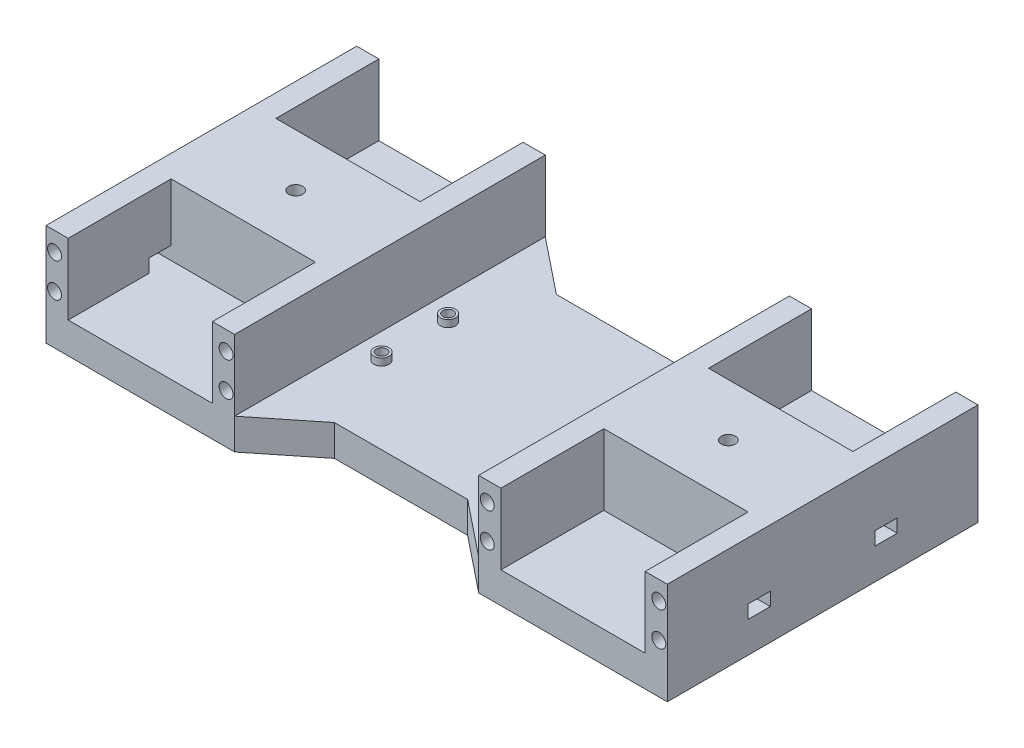
from build123d import *

# Parameters (mm, degrees)
SKETCH2_W           = 41.275
SKETCH2_H           = 29.464
BOSS_EXTRUDE1_DEPTH = 8.89
BOSS_EXTRUDE2_DEPTH = 29.14396
SKETCH6_R           = 2
CUT_EXTRUDE1_DEPTH  = 6.5
SKETCH7_R           = 2
CUT_EXTRUDE2_DEPTH  = 6
SKETCH8_R           = 2.135
SKETCH8_R_2         = 1.5
EXTRUDE_THIN1_DEPTH = 2
CUT_EXTRUDE3_START  = -21.78
SKETCH8_3_R         = 1.5
CUT_EXTRUDE3_DEPTH  = 21.78
CUT_EXTRUDE4_START  = -82.9
SKETCH7_2_R         = 2
CUT_EXTRUDE4_DEPTH  = 6
SKETCH9_W           = 6.35
SKETCH9_H           = 3.81
CUT_EXTRUDE5_DEPTH  = 6.35
CUT_EXTRUDE6_START  = -177.8
SKETCH9_2_W         = 6.35
SKETCH9_2_H         = 3.81
CUT_EXTRUDE6_DEPTH  = 6.35


with BuildPart() as part:
    # Sketch2 → Boss-Extrude1 (new body)
    with BuildSketch(Plane(origin=(0, 0, 0), x_dir=(1, 0, 0), z_dir=(0, 1, 0))):
        with Locations((26.9875, 74.168)):
            Rectangle(SKETCH2_W, SKETCH2_H)
        with Locations((26.9875, 14.732)):
            Rectangle(SKETCH2_W, SKETCH2_H)
        Polygon((0, 88.9), (0, 0), (6.35, 0), (6.35, 29.464), (47.625, 29.464), (47.625, 0), (53.975, 0), (53.975, 12.7), (53.975, 76.2), (53.975, 88.9), (47.625, 88.9), (47.625, 59.436), (6.35, 59.436), (6.35, 88.9), align=None)
        Polygon((53.975, 12.7), (69.85, 12.7), (107.95, 12.7), (123.825, 12.7), (123.825, 76.2), (107.95, 76.2), (69.85, 76.2), (53.975, 76.2), align=None)
        Polygon((53.975, 12.7), (53.975, 0), (69.85, 12.7), align=None)
        Polygon((107.95, 12.7), (123.825, 0), (123.825, 12.7), align=None)
        Polygon((123.825, 12.7), (123.825, 0), (130.175, 0), (130.175, 29.464), (171.45, 29.464), (171.45, 0), (177.8, 0), (177.8, 88.9), (171.45, 88.9), (171.45, 59.436), (130.175, 59.436), (130.175, 88.9), (123.825, 88.9), (123.825, 76.2), align=None)
        with Locations((150.8125, 14.732)):
            Rectangle(SKETCH2_W, SKETCH2_H)
        with Locations((150.8125, 74.168)):
            Rectangle(SKETCH2_W, SKETCH2_H)
        Polygon((123.825, 76.2), (123.825, 88.9), (107.95, 76.2), align=None)
        Polygon((69.85, 76.2), (53.975, 88.9), (53.975, 76.2), align=None)
    extrude(amount=BOSS_EXTRUDE1_DEPTH)

    # Sketch2<3> → Boss-Extrude2 (add)
    with BuildSketch(Plane(origin=(0, 0, 0), x_dir=(1, 0, 0), z_dir=(0, 1, 0))):
        Polygon((0, 88.9), (0, 0), (6.35, 0), (6.35, 29.464), (47.625, 29.464), (47.625, 0), (53.975, 0), (53.975, 12.7), (53.975, 76.2), (53.975, 88.9), (47.625, 88.9), (47.625, 59.436), (6.35, 59.436), (6.35, 88.9), align=None)
        Polygon((123.825, 12.7), (123.825, 0), (130.175, 0), (130.175, 29.464), (171.45, 29.464), (171.45, 0), (177.8, 0), (177.8, 88.9), (171.45, 88.9), (171.45, 59.436), (130.175, 59.436), (130.175, 88.9), (123.825, 88.9), (123.825, 76.2), align=None)
    extrude(amount=BOSS_EXTRUDE2_DEPTH)

    # Sketch6 → Cut-Extrude1 (cut)
    with BuildSketch(Plane(origin=(0, 29.14396, 0), x_dir=(1, 0, 0), z_dir=(0, 1, 0))):
        with Locations(Location((26.9875, 44.45, 0), (0, 0, 270))):
            Circle(SKETCH6_R)
        with Locations(Location((150.8125, 44.45, 0), (0, 0, 270))):
            Circle(SKETCH6_R)
    extrude(amount=-CUT_EXTRUDE1_DEPTH, mode=Mode.SUBTRACT)

    # Sketch7 → Cut-Extrude2 (cut)
    with BuildSketch(Plane.XY):
        with Locations((2.4375, 14.04)):
            Circle(SKETCH7_R)
        with Locations((51.5375, 14.04)):
            Circle(SKETCH7_R)
        with Locations((2.4375, 23.740006)):
            Circle(SKETCH7_R)
        with Locations((51.5375, 23.740006)):
            Circle(SKETCH7_R)
        with Locations(Location((126.2625, 23.740006, 0), (0, 0, 180))):
            Circle(SKETCH7_R)
        with Locations(Location((175.3625, 23.740006, 0), (0, 0, 180))):
            Circle(SKETCH7_R)
        with Locations(Location((126.2625, 14.04, 0), (0, 0, 180))):
            Circle(SKETCH7_R)
        with Locations(Location((175.3625, 14.04, 0), (0, 0, 180))):
            Circle(SKETCH7_R)
    extrude(amount=-CUT_EXTRUDE2_DEPTH, mode=Mode.SUBTRACT)

    # Sketch8 → Extrude-Thin1 (add)
    # profile 1 of 4: a face of its own
    with BuildSketch(Plane(origin=(0, 8.89, 0), x_dir=(1, 0, 0), z_dir=(0, 1, 0))):
        with Locations((61.087, 53.975)):
            Circle(SKETCH8_R)
        with Locations((61.087, 53.975)):
            Circle(SKETCH8_R_2, mode=Mode.SUBTRACT)
    # profile 2 of 4: a face of its own
    with BuildSketch(Plane(origin=(0, 8.89, 0), x_dir=(1, 0, 0), z_dir=(0, 1, 0))):
        with Locations((61.087, 34.925)):
            Circle(SKETCH8_R)
        with Locations((61.087, 34.925)):
            Circle(SKETCH8_R_2, mode=Mode.SUBTRACT)
    # profile 3 of 4: a face of its own
    with BuildSketch(Plane(origin=(0, 8.89, 0), x_dir=(1, 0, 0), z_dir=(0, 1, 0))):
        with Locations((116.713, 34.925)):
            Circle(SKETCH8_R)
        with Locations((116.713, 34.925)):
            Circle(SKETCH8_R_2, mode=Mode.SUBTRACT)
    # profile 4 of 4: a face of its own
    with BuildSketch(Plane(origin=(0, 8.89, 0), x_dir=(1, 0, 0), z_dir=(0, 1, 0))):
        with Locations((116.713, 53.975)):
            Circle(SKETCH8_R)
        with Locations((116.713, 53.975)):
            Circle(SKETCH8_R_2, mode=Mode.SUBTRACT)
    extrude(amount=EXTRUDE_THIN1_DEPTH)

    # Sketch8<3> → Cut-Extrude3 (cut)
    with BuildSketch(Plane(origin=(0, 8.89, 0), x_dir=(1, 0, 0), z_dir=(0, 1, 0)).offset(CUT_EXTRUDE3_START)):
        with Locations(Location((61.087, 53.975, 0), (0, 0, 270))):
            Circle(SKETCH8_3_R)
        with Locations(Location((61.087, 34.925, 0), (0, 0, 270))):
            Circle(SKETCH8_3_R)
        with Locations(Location((116.713, 34.925, 0), (0, 0, 270))):
            Circle(SKETCH8_3_R)
        with Locations(Location((116.713, 53.975, 0), (0, 0, 270))):
            Circle(SKETCH8_3_R)
    extrude(amount=CUT_EXTRUDE3_DEPTH, mode=Mode.SUBTRACT)

    # Sketch7<2> → Cut-Extrude4 (cut)
    with BuildSketch(Plane.XY.offset(CUT_EXTRUDE4_START)):
        with Locations((2.4375, 14.04)):
            Circle(SKETCH7_2_R)
        with Locations((51.5375, 14.04)):
            Circle(SKETCH7_2_R)
        with Locations((2.4375, 23.740006)):
            Circle(SKETCH7_2_R)
        with Locations((51.5375, 23.740006)):
            Circle(SKETCH7_2_R)
        with Locations(Location((126.2625, 23.740006, 0), (0, 0, 180))):
            Circle(SKETCH7_2_R)
        with Locations(Location((175.3625, 23.740006, 0), (0, 0, 180))):
            Circle(SKETCH7_2_R)
        with Locations(Location((126.2625, 14.04, 0), (0, 0, 180))):
            Circle(SKETCH7_2_R)
        with Locations(Location((175.3625, 14.04, 0), (0, 0, 180))):
            Circle(SKETCH7_2_R)
    extrude(amount=-CUT_EXTRUDE4_DEPTH, mode=Mode.SUBTRACT)

    # Sketch9 → Cut-Extrude5 (cut)
    with BuildSketch(Plane.ZY):
        with Locations((-26.289, 10.795)):
            Rectangle(SKETCH9_W, SKETCH9_H)
        with Locations((-62.611, 10.795)):
            Rectangle(SKETCH9_W, SKETCH9_H)
    extrude(amount=-CUT_EXTRUDE5_DEPTH, mode=Mode.SUBTRACT)

    # Sketch9<2> → Cut-Extrude6 (cut)
    with BuildSketch(Plane.ZY.offset(CUT_EXTRUDE6_START)):
        with Locations((-26.289, 10.795)):
            Rectangle(SKETCH9_2_W, SKETCH9_2_H)
        with Locations((-62.611, 10.795)):
            Rectangle(SKETCH9_2_W, SKETCH9_2_H)
    extrude(amount=CUT_EXTRUDE6_DEPTH, mode=Mode.SUBTRACT)


solid = part.part
